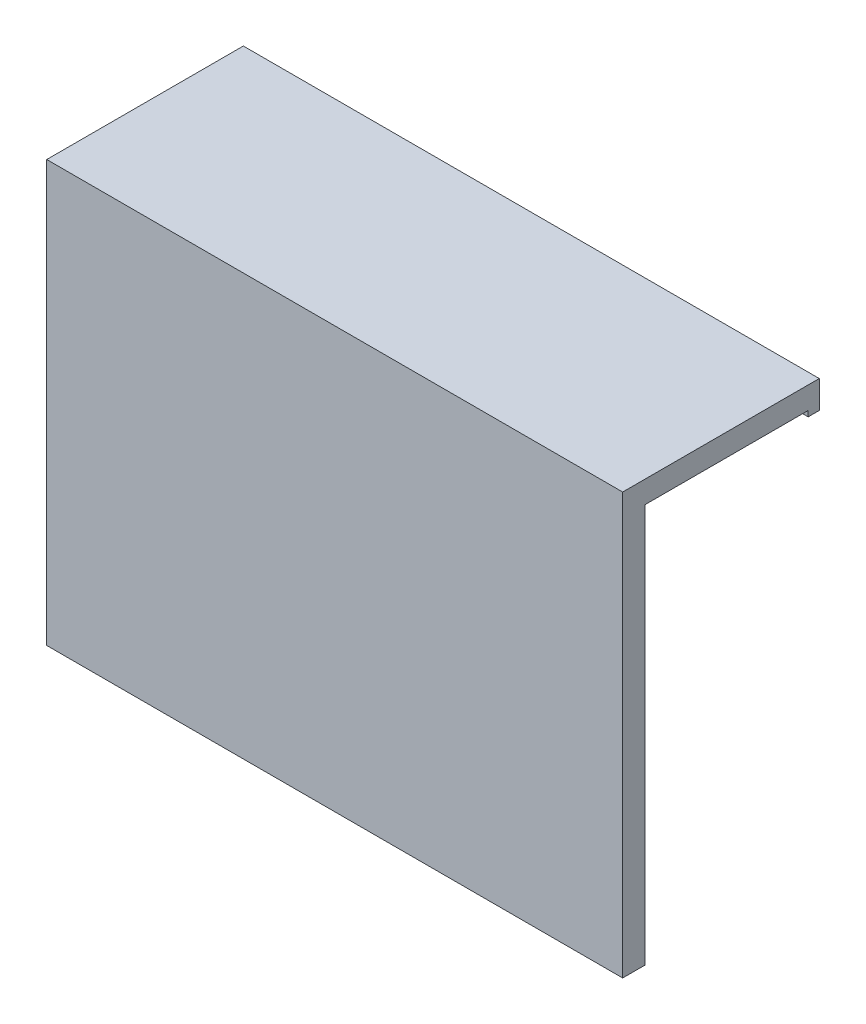
from build123d import *

# Parameters (mm, degrees)
SKETCH1_W               = 104
SKETCH1_H               = 74
BOSS_EXTRUDE1_DEPTH     = 1
BOSS_EXTRUDE2_DEPTH     = 3
BOSS_EXTRUDE3_DEPTH     = 29.5
SKETCH3_W               = 104
SKETCH3_H               = 4
BOSS_EXTRUDE4_DEPTH     = 2
CUT_EXTRUDE1_DEPTH      = 11
CUT_EXTRUDE1_DEPTH_BACK = 11
CUT_EXTRUDE1_START      = -52
SKETCH5_W               = 104
SKETCH5_H               = 5
BOSS_EXTRUDE6_DEPTH     = 2
CUT_EXTRUDE2_START      = -32
CUT_EXTRUDE2_DEPTH      = 11
CUT_EXTRUDE3_START      = -83
CUT_EXTRUDE3_DEPTH      = 11


with BuildPart() as part:
    # Sketch1 → Boss-Extrude1 (new body)
    with BuildSketch(Plane.XY):
        with Locations((50, 37)):
            Rectangle(SKETCH1_W, SKETCH1_H)
    extrude(amount=BOSS_EXTRUDE1_DEPTH)

    # Sketch1<3> → Boss-Extrude2 (add)
    with BuildSketch(Plane.XY):
        Polygon((-2, 74), (-2, 0), (0, 0), (0, 72), (100, 72), (100, 0), (102, 0), (102, 74), align=None)
    extrude(amount=-BOSS_EXTRUDE2_DEPTH)

    # Sketch2 → Boss-Extrude3 (add)
    with BuildSketch(Plane(origin=(0, 0, -3), x_dir=(-1, 0, 0), z_dir=(0, 0, -1))):
        Polygon((-102, 74), (2, 74), (2, 70), (0, 70), (0, 72), (-100, 72), (-100, 70), (-102, 70), align=None)
    extrude(amount=BOSS_EXTRUDE3_DEPTH)

    # Sketch3 → Boss-Extrude4 (add)
    with BuildSketch(Plane.XZ):
        with Locations((50, -1)):
            Rectangle(SKETCH3_W, SKETCH3_H)
    extrude(amount=BOSS_EXTRUDE4_DEPTH)

    # Sketch4 → Cut-Extrude1 (cut, two sides: drawn at the far end of the back side and taken through both)
    with BuildSketch(Plane.ZY.offset(2).offset(CUT_EXTRUDE1_START - CUT_EXTRUDE1_DEPTH_BACK)):
        with BuildLine():
            Line((0, 0), (-2.4, 0))
            ThreePointArc((-2.4, 0), (-1.2, -1.2), (0, 0))
        make_face()
    extrude(amount=CUT_EXTRUDE1_DEPTH + CUT_EXTRUDE1_DEPTH_BACK, mode=Mode.SUBTRACT)

    # Sketch5 → Boss-Extrude6 (add)
    with BuildSketch(Plane(origin=(0, 0, -32.5), x_dir=(-1, 0, 0), z_dir=(0, 0, -1))):
        with Locations((-50, 71.5)):
            Rectangle(SKETCH5_W, SKETCH5_H)
    extrude(amount=BOSS_EXTRUDE6_DEPTH)

    # Sketch6 → Cut-Extrude2 (cut)
    with BuildSketch(Plane.ZY.offset(2).offset(CUT_EXTRUDE2_START)):
        with BuildLine():
            ThreePointArc((-32.5, 72.2), (-33.7, 71), (-32.5, 69.8))
            Line((-32.5, 69.8), (-32.5, 72.2))
        make_face()
    extrude(amount=CUT_EXTRUDE2_DEPTH, mode=Mode.SUBTRACT)

    # Sketch6<3> → Cut-Extrude3 (cut)
    with BuildSketch(Plane.ZY.offset(2).offset(CUT_EXTRUDE3_START)):
        with BuildLine():
            ThreePointArc((-32.5, 72.2), (-33.7, 71), (-32.5, 69.8))
            Line((-32.5, 69.8), (-32.5, 72.2))
        make_face()
    extrude(amount=CUT_EXTRUDE3_DEPTH, mode=Mode.SUBTRACT)


solid = part.part
